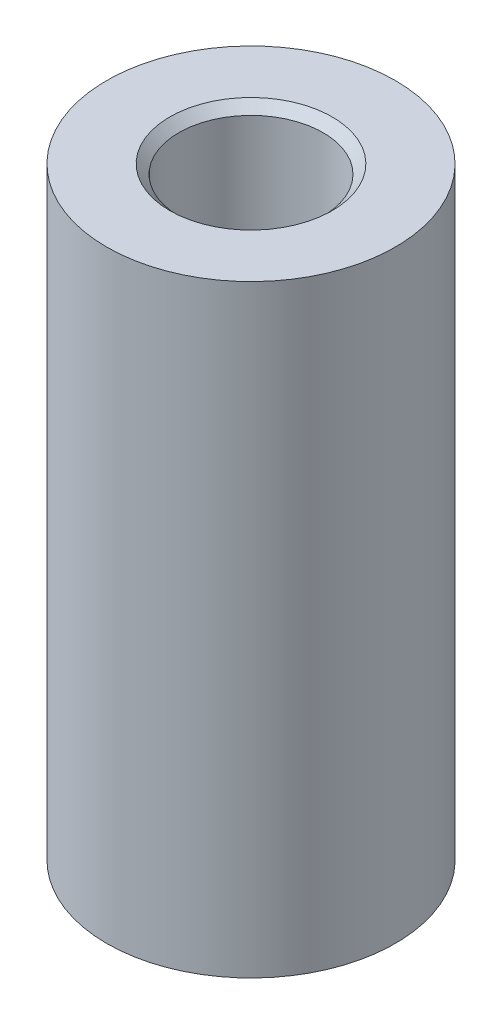
from build123d import *

# Parameters (mm, degrees)
SKETCH1_R           = 6.35
SKETCH1_R_2         = 3.175
BOSS_EXTRUDE1_DEPTH = 26.543
CHAMFER1_SIZE       = 0.4


with BuildPart() as part:
    # Sketch1 → Boss-Extrude1 (new body)
    with BuildSketch(Plane(origin=(0, 0, 0), x_dir=(1, 0, 0), z_dir=(0, 1, 0))):
        with Locations(Location((0, 0, 0), (0, 0, 270))):
            Circle(SKETCH1_R)
        with Locations(Location((0, 0, 0), (0, 0, 270))):
            Circle(SKETCH1_R_2, mode=Mode.SUBTRACT)
    extrude(amount=BOSS_EXTRUDE1_DEPTH)

    # Chamfer1
    chamfer1_edges = [part.edges().sort_by_distance(p)[0] for p in [
        (0, 0, -3.175),
        (0, 26.543, -3.175),
    ]]
    chamfer(chamfer1_edges, length=CHAMFER1_SIZE)


solid = part.part
